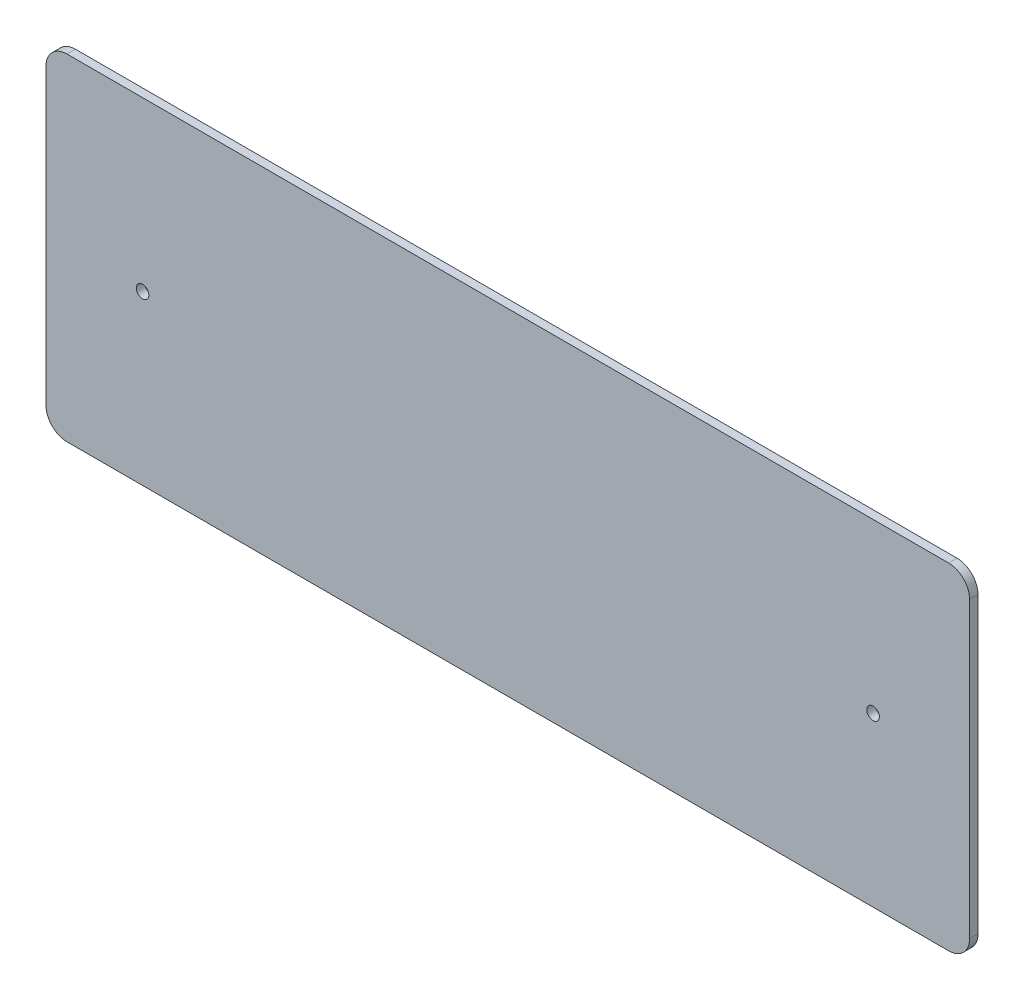
from build123d import *

# Parameters (mm, degrees)
SKETCH_1_W      = 220
SKETCH_1_H      = 80
SKETCH_1_R      = 1.5
EXTRUDE_1_DEPTH = 2
FILLET_1_R      = 5


with BuildPart() as part:
    # 草图1 → 凸台-拉伸1 (new body)
    with BuildSketch(Plane.XY):
        Rectangle(SKETCH_1_W, SKETCH_1_H)
        with Locations((87, 0)):
            Circle(SKETCH_1_R, mode=Mode.SUBTRACT)
        with Locations((-87, 0)):
            Circle(SKETCH_1_R, mode=Mode.SUBTRACT)
    extrude(amount=EXTRUDE_1_DEPTH)

    # 圆角1
    fillet_1_edges = [part.edges().sort_by_distance(p)[0] for p in [
        (110, -40, 1),
        (-110, -40, 1),
        (-110, 40, 1),
        (110, 40, 1),
    ]]
    fillet(fillet_1_edges, radius=FILLET_1_R)


solid = part.part
